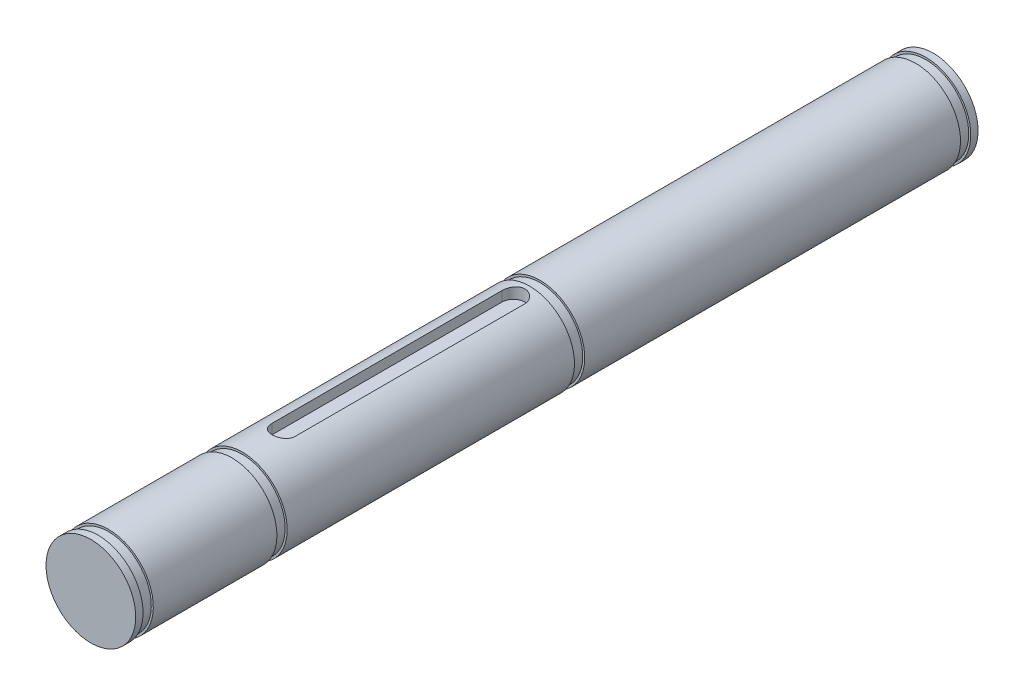
from build123d import *

# Parameters (mm, degrees)
SKETCH1_W          = 116.84
SKETCH1_H          = 6.223
SKETCH3_W          = 1.4224
SKETCH3_H          = 0.5588
CUT_EXTRUDE1_DEPTH = 1.5875


with BuildPart() as part:
    # Sketch1 → Revolve1 (revolve)
    with BuildSketch(Plane(origin=(0, 0, 0), x_dir=(0, 0, -1), z_dir=(1, 0, 0))):
        with Locations((58.42, 3.1115)):
            Rectangle(SKETCH1_W, SKETCH1_H)
    revolve(axis=Axis((0, 0, 0), (0, 0, 1)))

    # Sketch3 → Cut-Revolve1 (revolve, cut)
    with BuildSketch(Plane(origin=(0, 0, 0), x_dir=(0, 0, -1), z_dir=(1, 0, 0))):
        with Locations((1.7272, 6.223)):
            Rectangle(SKETCH3_W, SKETCH3_H)
        with Locations((61.5696, 6.223)):
            Rectangle(SKETCH3_W, SKETCH3_H)
        with Locations((20.2946, 6.223)):
            Rectangle(SKETCH3_W, SKETCH3_H)
        with Locations((115.1128, 6.223)):
            Rectangle(SKETCH3_W, SKETCH3_H)
    revolve(axis=Axis((0, 0, 0), (0, 0, 1)), mode=Mode.SUBTRACT)

    # Sketch4 → Cut-Extrude1 (cut)
    with BuildSketch(Plane(origin=(0, 6.223, 0), x_dir=(1, 0, 0), z_dir=(0, 1, 0))):
        with BuildLine():
            Line((-1.5875, 26.7335), (-1.5875, 58.6105))
            ThreePointArc((-1.5875, 58.6105), (0, 60.198), (1.5875, 58.6105))
            Line((1.5875, 58.6105), (1.5875, 26.7335))
            ThreePointArc((1.5875, 26.7335), (0, 25.146), (-1.5875, 26.7335))
        make_face()
    extrude(amount=-CUT_EXTRUDE1_DEPTH, mode=Mode.SUBTRACT)


solid = part.part
